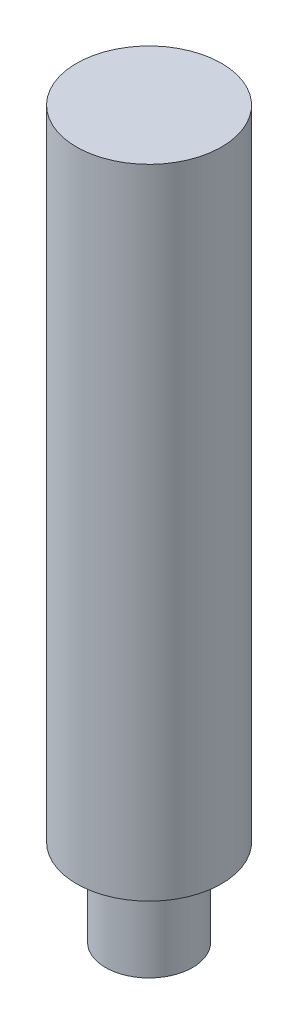
from build123d import *


with BuildPart() as part:
    # Sketch1 → Revolve1 (revolve)
    with BuildSketch(Plane(origin=(0, 0, 0), x_dir=(0, 0, -1), z_dir=(1, 0, 0))):
        Polygon((0, 0), (0, 25), (2.5, 25), (2.5, 3), (1.5, 3), (1.5, 0), align=None)
    revolve(axis=Axis((0, 0, 0), (0, 1, 0)))


solid = part.part
